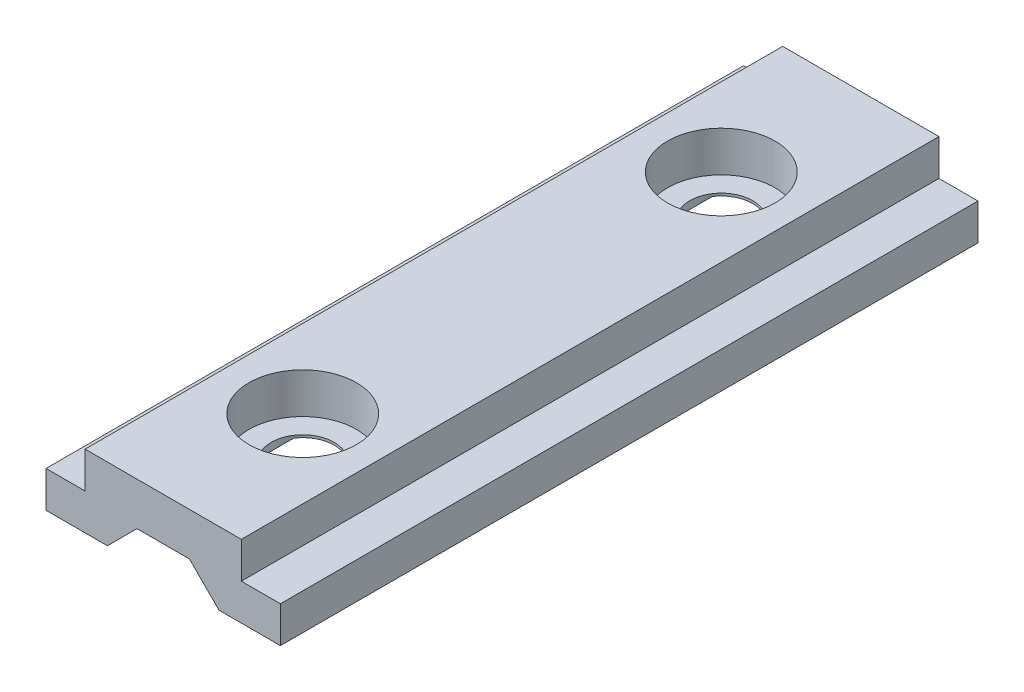
from build123d import *

# Parameters (mm, degrees)
EXTRUDE_1_DEPTH              = 50
HOLE_WIZARD_M4_1_D           = 4.5
HOLE_WIZARD_M4_1_CBORE_D     = 7.7
HOLE_WIZARD_M4_1_CBORE_DEPTH = 2.9


with BuildPart() as part:
    # ｽｹｯﾁ1 → ﾎﾞｽ - 押し出し1 (new body)
    with BuildSketch(Plane.XY):
        Polygon((0, 0), (4.4, 0), (6.520098337, 2.120098337), (10.279901663, 2.120098337), (12.4, 0), (16.8, 0), (16.8, 2.6), (14, 2.6), (14, 5.2), (2.8, 5.2), (2.8, 2.6), (0, 2.6), align=None)
    extrude(amount=EXTRUDE_1_DEPTH)

    # M4 丸平ねじ用座ぐり穴1 (through all)
    with Locations(Plane(origin=(8.4, 5.2, 10), x_dir=(1, 0, 0), z_dir=(0, 1, 0))):
        with Locations((0, 0), (0, -30)):
            CounterBoreHole(HOLE_WIZARD_M4_1_D / 2, HOLE_WIZARD_M4_1_CBORE_D / 2, HOLE_WIZARD_M4_1_CBORE_DEPTH)


solid = part.part
